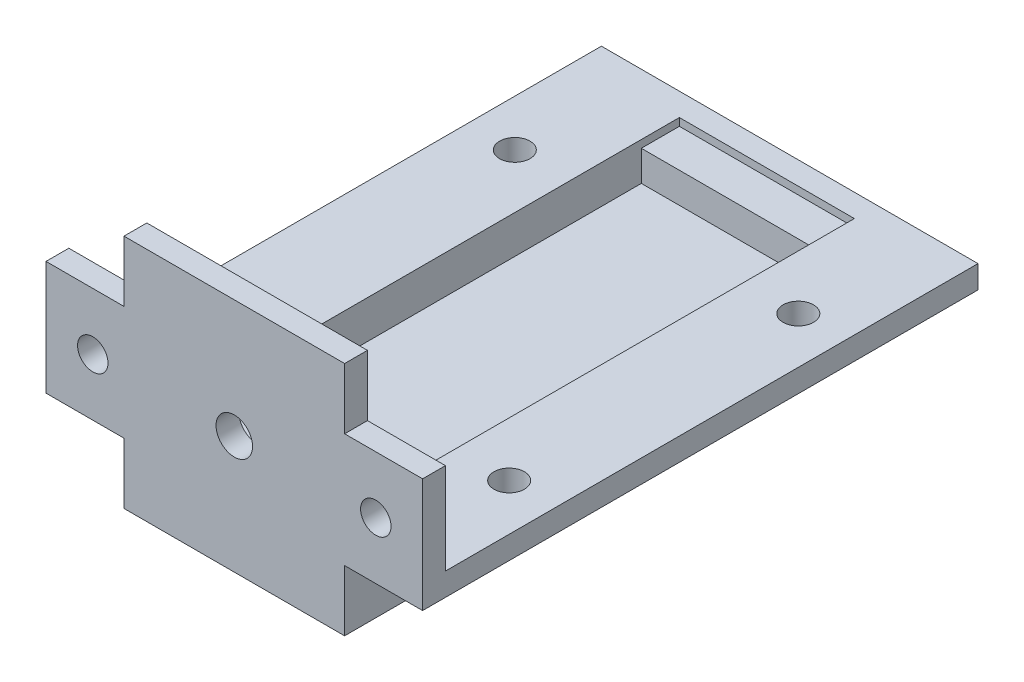
from build123d import *

# Parameters (mm, degrees)
SALIENTE_EXTRUIR2_DEPTH = 3
SALIENTE_EXTRUIR3_DEPTH = 70
CROQUIS_HUECO_MOTOR_W   = 23
CROQUIS_HUECO_MOTOR_H   = 67
HUECO_MOTOR_DEPTH       = 5
CROQUIS10_R             = 2.4
CROQUIS10_R_2           = 2
TORNILLO_Y_MOTOR_DEPTH  = 5
CROQUIS12_W             = 23
CROQUIS12_H             = 5
SALIENTE_EXTRUIR5_DEPTH = 4
CROQUIS16_R             = 2
CORTAR_EXTRUIR4_DEPTH   = 77.893188905


with BuildPart() as part:
    # Croquis4 → Saliente-Extruir2 (new body)
    with BuildSketch(Plane.XY):
        Polygon((14.5, 16), (-14.5, 16), (-14.5, 8), (-24.75, 8), (-24.75, -7), (-14.5, -7), (-14.5, -15), (14.5, -15), (14.5, -7), (24.75, -7), (24.75, 8), (14.5, 8), align=None)
    extrude(amount=SALIENTE_EXTRUIR2_DEPTH)

    # Croquis5 → Saliente-Extruir3 (add)
    with BuildSketch(Plane(origin=(0, 0, 0), x_dir=(-1, 0, 0), z_dir=(0, 0, -1))):
        Polygon((-24.75, -4), (-24.75, -7), (-14.5, -7), (-14.5, -15), (14.5, -15), (14.5, -7), (24.75, -7), (24.75, -4), align=None)
    extrude(amount=SALIENTE_EXTRUIR3_DEPTH)

    # croquis hueco motor → hueco motor (cut)
    with BuildSketch(Plane(origin=(0, -4, 0), x_dir=(1, 0, 0), z_dir=(0, 1, 0))):
        with Locations((0, 33.5)):
            Rectangle(CROQUIS_HUECO_MOTOR_W, CROQUIS_HUECO_MOTOR_H)
    extrude(amount=-HUECO_MOTOR_DEPTH, mode=Mode.SUBTRACT)

    # Croquis10 → tornillo y motor (cut)
    with BuildSketch(Plane.XY.offset(3)):
        with Locations((0, 0.5)):
            Circle(CROQUIS10_R)
        with Locations((-18.6, 0.5)):
            Circle(CROQUIS10_R_2)
        with Locations(Location((18.6, 0.5, 0), (0, 0, 180))):
            Circle(CROQUIS10_R_2)
    extrude(amount=-TORNILLO_Y_MOTOR_DEPTH, mode=Mode.SUBTRACT)

    # Croquis12 → Saliente-Extruir5 (add)
    with BuildSketch(Plane(origin=(0, -9, 0), x_dir=(1, 0, 0), z_dir=(0, 1, 0))):
        with Locations((0, 64.5)):
            Rectangle(CROQUIS12_W, CROQUIS12_H)
    extrude(amount=SALIENTE_EXTRUIR5_DEPTH)

    # Croquis16 → Cortar-Extruir4 (cut, through all)
    with BuildSketch(Plane(origin=(0, -4, 0), x_dir=(1, 0, 0), z_dir=(0, 1, 0))):
        with Locations(Location((-18.63, 52.5, 0), (0, 0, 180))):
            Circle(CROQUIS16_R)
        with Locations(Location((-18.63, 14.5, 0), (0, 0, 270))):
            Circle(CROQUIS16_R)
        with Locations(Location((18.63, 14.5, 0), (0, 0, 180))):
            Circle(CROQUIS16_R)
        with Locations(Location((18.63, 52.5, 0), (0, 0, 180))):
            Circle(CROQUIS16_R)
    extrude(amount=-CORTAR_EXTRUIR4_DEPTH, mode=Mode.SUBTRACT)


solid = part.part
